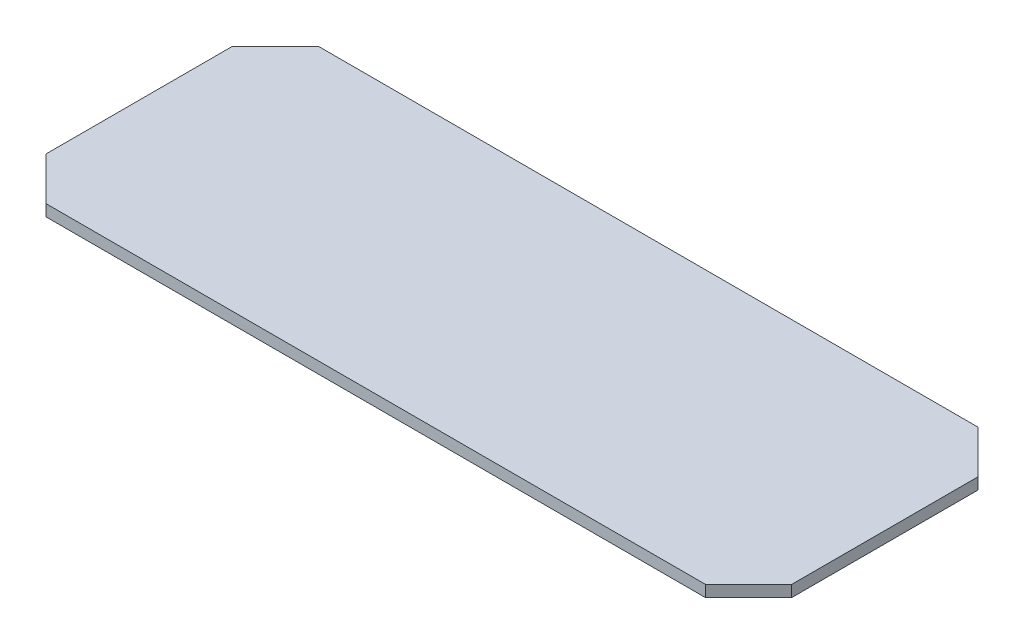
from build123d import *

# Parameters (mm, degrees)
SKETCH_1_W      = 130
SKETCH_1_H      = 47.5
EXTRUDE_1_DEPTH = 2
CHAMFER_1_SIZE  = 7.5


with BuildPart() as part:
    # 草图1 → 凸台-拉伸1 (new body)
    with BuildSketch(Plane(origin=(0, 0, 0), x_dir=(1, 0, 0), z_dir=(0, 1, 0))):
        Rectangle(SKETCH_1_W, SKETCH_1_H)
    extrude(amount=EXTRUDE_1_DEPTH)

    # 倒角1
    chamfer_1_edges = [part.edges().sort_by_distance(p)[0] for p in [
        (-65, 1, -23.75),
        (65, 1, -23.75),
        (65, 1, 23.75),
        (-65, 1, 23.75),
    ]]
    chamfer(chamfer_1_edges, length=CHAMFER_1_SIZE)


solid = part.part
